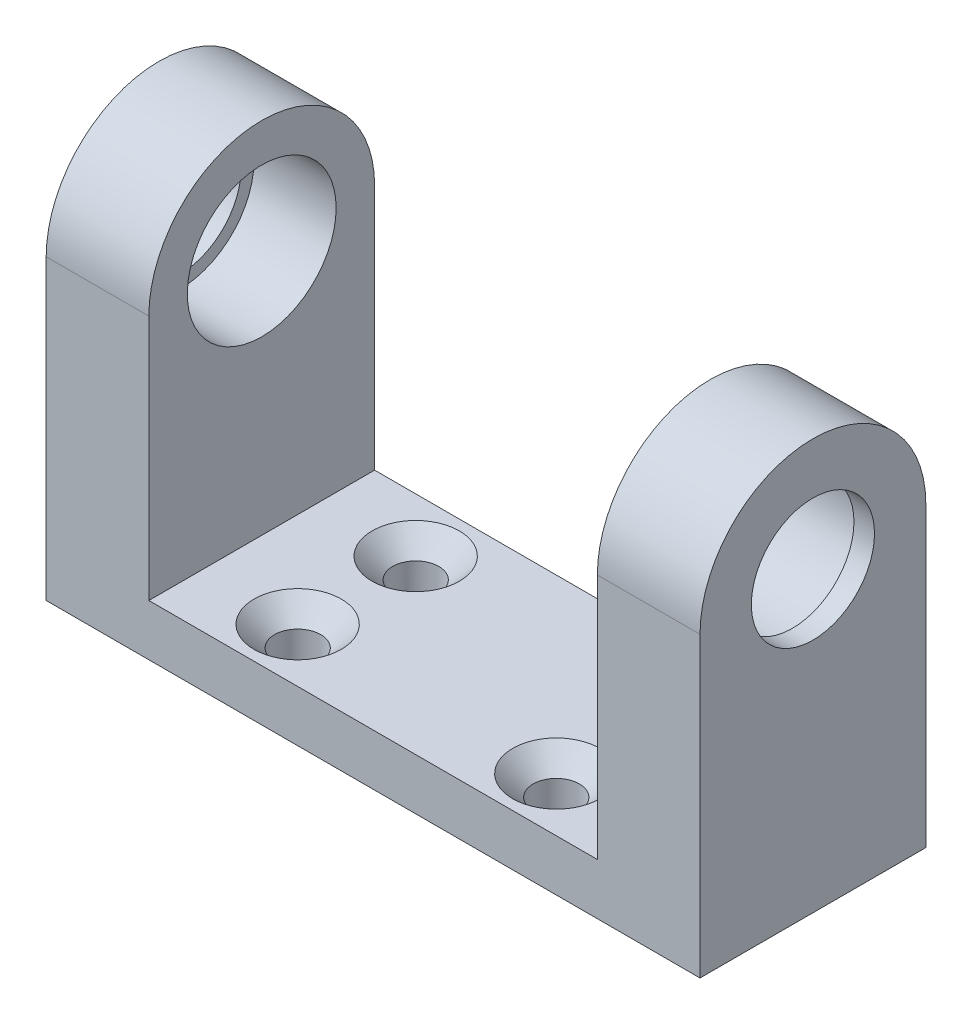
from build123d import *

# Parameters (mm, degrees)
BOSS_EXTRUDE1_DEPTH = 11
SKETCH2_R           = 6
CUT_EXTRUDE1_DEPTH  = 68.666018059
SKETCH3_R           = 2.25
CUT_EXTRUDE2_DEPTH  = 58.635080463
CHAMFER1_SIZE       = 2
CUT_EXTRUDE3_START  = -61.7
SKETCH4_R           = 7.25
CUT_EXTRUDE3_DEPTH  = 59.7


with BuildPart() as part:
    # Sketch1 → Boss-Extrude1 (new, symmetric)
    with BuildSketch(Plane.XY):
        Polygon((-19.25, 20), (-19.25, -20), (44.45, -20), (44.45, 20), (34.45, 20), (34.45, -15), (-9.25, -15), (-9.25, 20), align=None)
    extrude(amount=BOSS_EXTRUDE1_DEPTH, both=True)

    # Sketch2 → Cut-Extrude1 (cut, through all)
    with BuildSketch(Plane(origin=(44.45, 0, 0), x_dir=(0, 0, -1), z_dir=(1, 0, 0))):
        with Locations((0, 9)):
            Circle(SKETCH2_R)
        with BuildLine():
            Line((-11, 9), (-11, 20))
            Line((-11, 20), (-11, 31))
            Line((-11, 31), (11, 31))
            Line((11, 31), (11, 20))
            Line((11, 20), (11, 9))
            ThreePointArc((11, 9), (7.778174593, 16.778174593), (0, 20))
            ThreePointArc((0, 20), (-7.778174593, 16.778174593), (-11, 9))
        make_face()
    extrude(amount=-CUT_EXTRUDE1_DEPTH, mode=Mode.SUBTRACT)

    # Sketch3 → Cut-Extrude2 (cut, through all)
    with BuildSketch(Plane(origin=(0, -15, 0), x_dir=(1, 0, 0), z_dir=(0, 1, 0))):
        with Locations(Location((0, 5.75, 0), (0, 0, 270))):
            Circle(SKETCH3_R)
        with Locations(Location((0, -5.75, 0), (0, 0, 270))):
            Circle(SKETCH3_R)
        with Locations(Location((25.2, 5.75, 0), (0, 0, 270))):
            Circle(SKETCH3_R)
        with Locations(Location((25.2, -5.75, 0), (0, 0, 270))):
            Circle(SKETCH3_R)
    extrude(amount=-CUT_EXTRUDE2_DEPTH, mode=Mode.SUBTRACT)

    # Chamfer1
    chamfer1_edges = [part.edges().sort_by_distance(p)[0] for p in [
        (0, -15, 3.5),
        (25.2, -15, -8),
        (25.2, -15, 3.5),
        (0, -15, -8),
    ]]
    chamfer(chamfer1_edges, length=CHAMFER1_SIZE)

    # Sketch4 → Cut-Extrude3 (cut)
    with BuildSketch(Plane(origin=(44.45, 0, 0), x_dir=(0, 0, -1), z_dir=(1, 0, 0)).offset(CUT_EXTRUDE3_START)):
        with Locations((0, 9)):
            Circle(SKETCH4_R)
    extrude(amount=CUT_EXTRUDE3_DEPTH, mode=Mode.SUBTRACT)


solid = part.part
